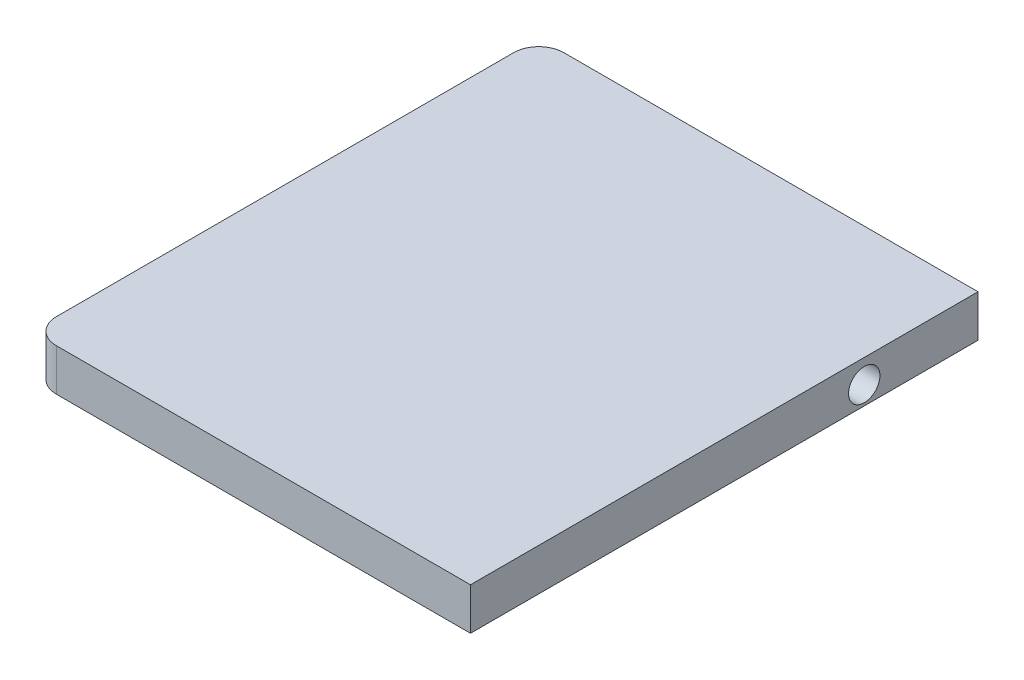
from build123d import *

# Parameters (mm, degrees)
SKETCH1_W           = 44.45
SKETCH1_H           = 51.3588
BOSS_EXTRUDE1_DEPTH = 4.7625
CUT_EXTRUDE1_DEPTH  = 29.94025
FILLET1_R           = 2.54
CHAMFER1_SIZE       = 0.508


with BuildPart() as part:
    # Sketch1 → Boss-Extrude1 (new body)
    with BuildSketch(Plane(origin=(0, 0, 0), x_dir=(1, 0, 0), z_dir=(0, 1, 0))):
        Rectangle(SKETCH1_W, SKETCH1_H)
    extrude(amount=BOSS_EXTRUDE1_DEPTH)

    # Sketch2 → Cut-Extrude1 (cut)
    with BuildSketch(Plane(origin=(22.225, 0, 0), x_dir=(0, 0, -1), z_dir=(1, 0, 0))):
        with BuildLine():
            ThreePointArc((15.757525, 2.38125), (15.292557015, 3.503782015), (14.170025, 3.96875))
            Line((14.170025, 3.96875), (14.170025, 0.79375))
            ThreePointArc((14.170025, 0.79375), (15.292557015, 1.258717985), (15.757525, 2.38125))
        make_face()
        with BuildLine():
            Line((14.170025, 0.79375), (14.170025, 3.96875))
            ThreePointArc((14.170025, 3.96875), (12.582525, 2.38125), (14.170025, 0.79375))
        make_face()
    extrude(amount=-CUT_EXTRUDE1_DEPTH, mode=Mode.SUBTRACT)

    # Fillet1
    fillet1_edges = [part.edges().sort_by_distance(p)[0] for p in [
        (-22.225, 2.38125, -25.6794),
        (-22.225, 2.38125, 25.6794),
    ]]
    fillet(fillet1_edges, radius=FILLET1_R)

    # Chamfer1
    chamfer1_edges = [part.edges().sort_by_distance(p)[0] for p in [
        (-22.225, 0, 0),
        (1.27, 0, 25.6794),
        (-21.481051224, 0, 24.935451224),
        (-21.481051224, 0, -24.935451224),
        (1.27, 0, -25.6794),
        (22.225, 0, 0),
    ]]
    chamfer(chamfer1_edges, length=CHAMFER1_SIZE)


solid = part.part
